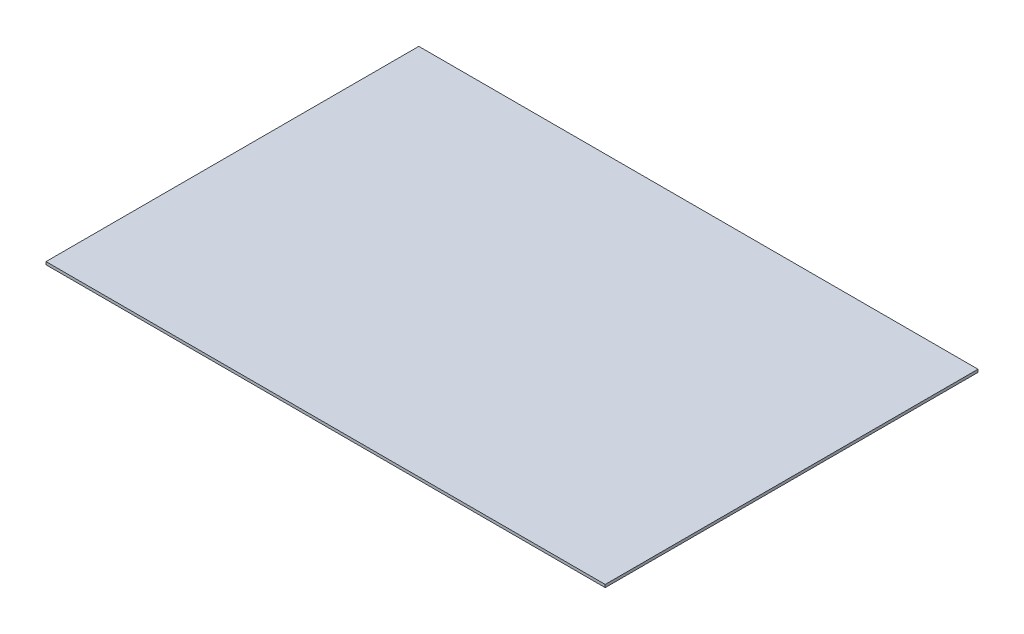
from build123d import *

# Parameters (mm, degrees)
SKETCH1_W           = 300
SKETCH1_H           = 200
BOSS_EXTRUDE1_DEPTH = 1.5


with BuildPart() as part:
    # Sketch1 → Boss-Extrude1 (new body)
    with BuildSketch(Plane(origin=(0, 0, 0), x_dir=(1, 0, 0), z_dir=(0, 1, 0))):
        with Locations((150, 100)):
            Rectangle(SKETCH1_W, SKETCH1_H)
    extrude(amount=BOSS_EXTRUDE1_DEPTH)


solid = part.part
